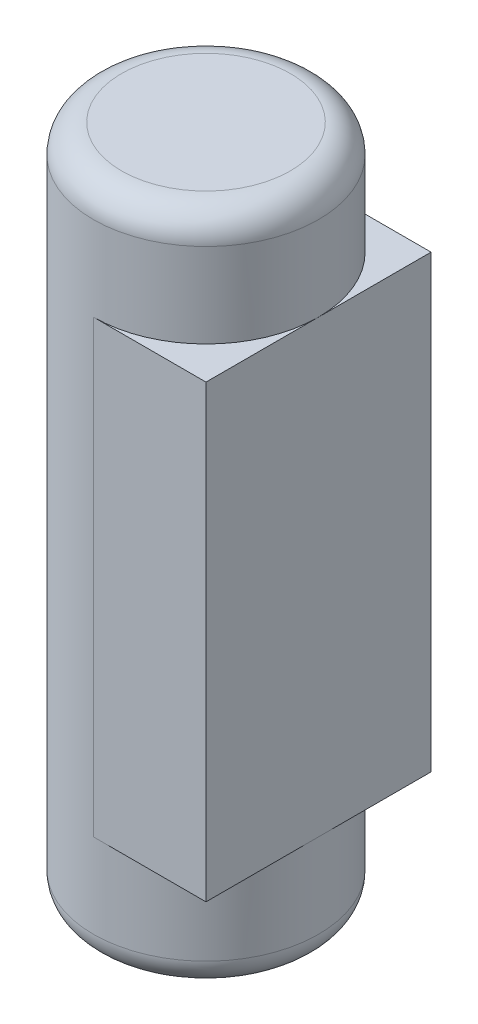
from build123d import *

# Parameters (mm, degrees)
SKETCH1_R           = 50.8
BOSS_EXTRUDE1_DEPTH = 304.8
SKETCH2_W           = 101.6
SKETCH2_H           = 203.2
BOSS_EXTRUDE2_DEPTH = 50.8
FILLET1_R           = 12.7


with BuildPart() as part:
    # Sketch1 → Boss-Extrude1 (new body)
    with BuildSketch(Plane(origin=(0, 0, 0), x_dir=(1, 0, 0), z_dir=(0, 1, 0))):
        with Locations(Location((0, 0, 0), (0, 0, 90))):
            Circle(SKETCH1_R)
    extrude(amount=BOSS_EXTRUDE1_DEPTH)

    # Sketch2 → Boss-Extrude2 (add)
    with BuildSketch(Plane(origin=(0, 0, 0), x_dir=(0, 0, -1), z_dir=(1, 0, 0))):
        with Locations((0, 152.4)):
            Rectangle(SKETCH2_W, SKETCH2_H)
    extrude(amount=BOSS_EXTRUDE2_DEPTH)

    # Fillet1
    fillet1_edges = [part.edges().sort_by_distance(p)[0] for p in [
        (0, 0, 50.8),
        (0, 304.8, 50.8),
    ]]
    fillet(fillet1_edges, radius=FILLET1_R)


solid = part.part
